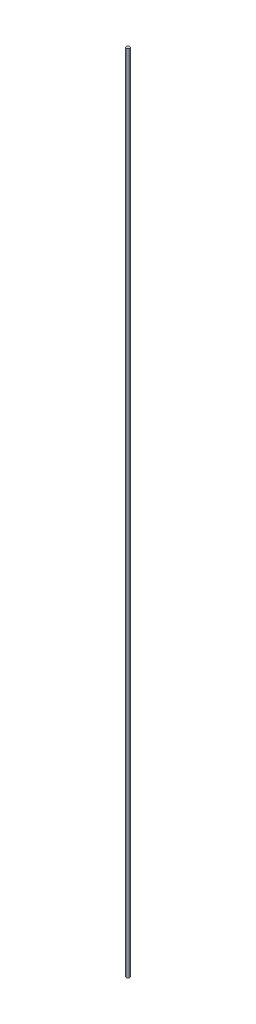
from build123d import *

# Parameters (mm, degrees)
SKETCH1_R           = 0.75
BOSS_EXTRUDE1_DEPTH = 180


with BuildPart() as part:
    # Sketch1 → Boss-Extrude1 (new, symmetric)
    with BuildSketch(Plane(origin=(0, 0, 0), x_dir=(1, 0, 0), z_dir=(0, 1, 0))):
        with Locations(Location((0, 0, 0), (0, 0, 90))):
            Circle(SKETCH1_R)
    extrude(amount=BOSS_EXTRUDE1_DEPTH, both=True)


solid = part.part
